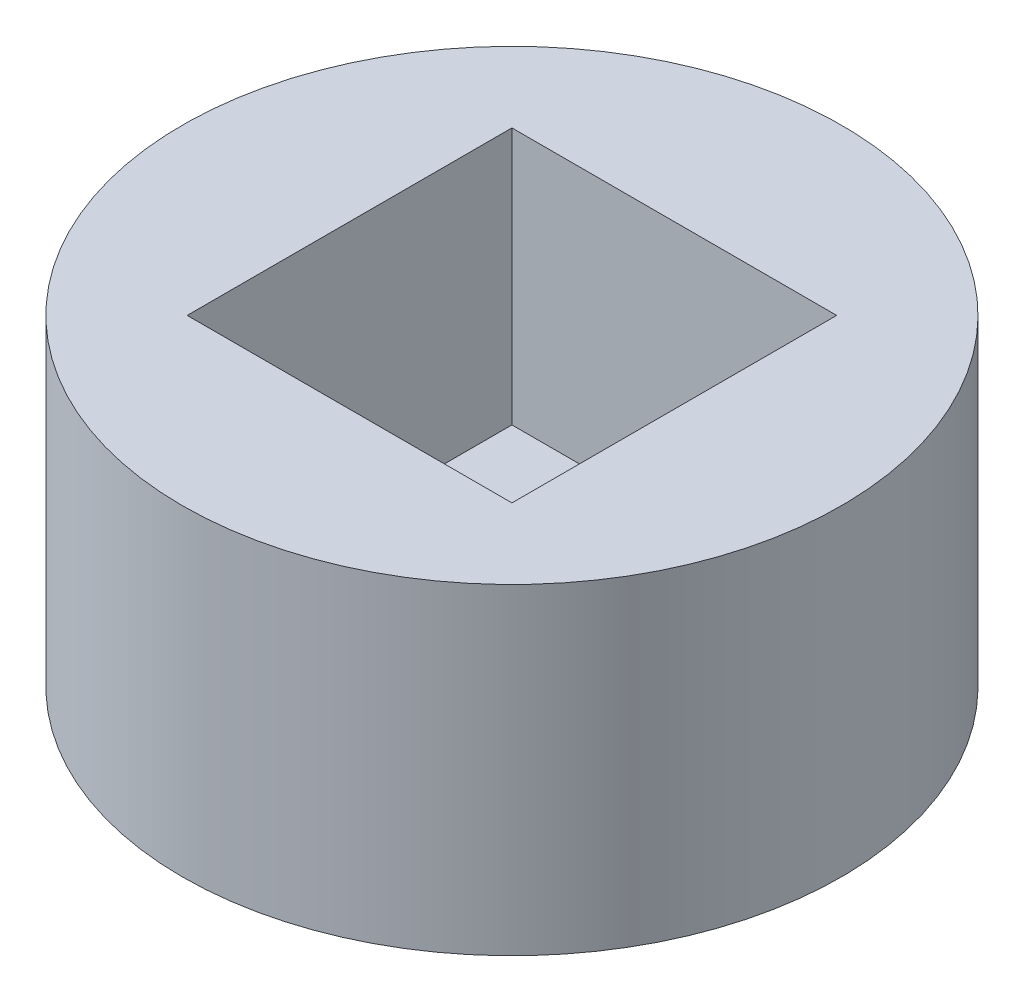
from build123d import *

# Parameters (mm, degrees)
SKETCH1_R           = 26.035
BOSS_EXTRUDE1_DEPTH = 25.4
SKETCH2_W           = 25.654
SKETCH2_H           = 25.654
CUT_EXTRUDE1_DEPTH  = 20.32


with BuildPart() as part:
    # Sketch1 → Boss-Extrude1 (new body)
    with BuildSketch(Plane(origin=(0, 0, 0), x_dir=(1, 0, 0), z_dir=(0, 1, 0))):
        with Locations(Location((0, 0, 0), (0, 0, 270))):
            Circle(SKETCH1_R)
    extrude(amount=BOSS_EXTRUDE1_DEPTH)

    # Sketch2 → Cut-Extrude1 (cut)
    with BuildSketch(Plane(origin=(0, 25.4, 0), x_dir=(1, 0, 0), z_dir=(0, 1, 0))):
        Rectangle(SKETCH2_W, SKETCH2_H)
    extrude(amount=-CUT_EXTRUDE1_DEPTH, mode=Mode.SUBTRACT)


solid = part.part
